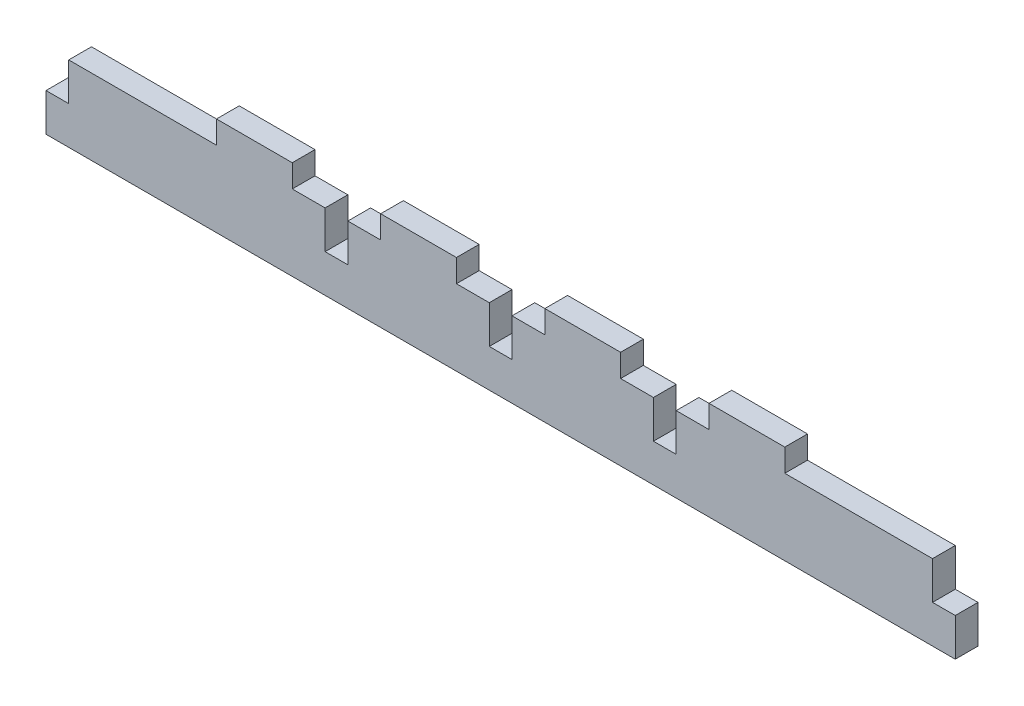
from build123d import *

# Parameters (mm, degrees)
BOSS_EXTRUDE1_DEPTH = 9


with BuildPart() as part:
    # Model → Boss-Extrude1 (new body)
    with BuildSketch(Plane.XY):
        Polygon((112.5, 30), (171, 30), (171, 15), (180, 15), (180, 0), (-180, 0), (-180, 15), (-171, 15), (-171, 30), (-112.5, 30), (-112.5, 39), (-82.5, 39), (-82.5, 30), (-69.5, 30), (-69.5, 15), (-60.5, 15), (-60.5, 30), (-47.5, 30), (-47.5, 39), (-17.5, 39), (-17.5, 30), (-4.5, 30), (-4.5, 15), (4.5, 15), (4.5, 30), (17.5, 30), (17.5, 39), (47.5, 39), (47.5, 30), (60.5, 30), (60.5, 15), (69.5, 15), (69.5, 30), (82.5, 30), (82.5, 39), (112.5, 39), align=None)
    extrude(amount=BOSS_EXTRUDE1_DEPTH)


solid = part.part
